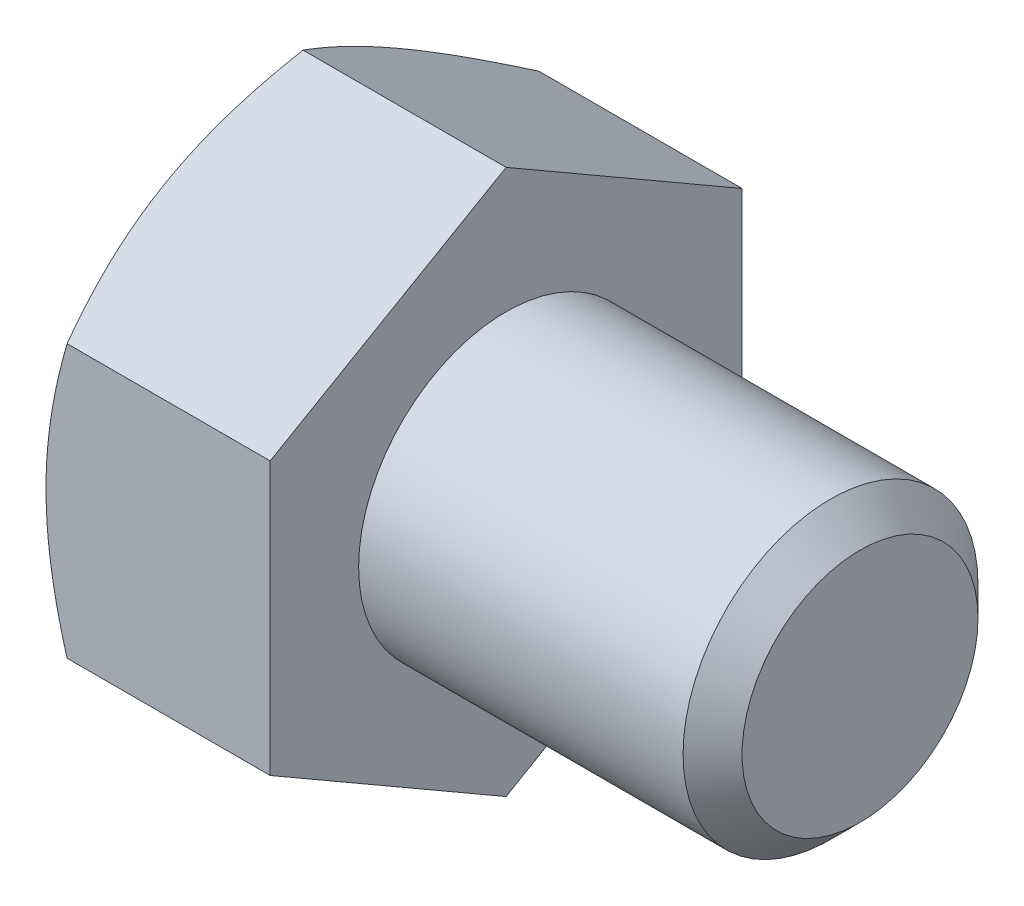
from build123d import *

# Parameters (mm, degrees)
SKETCH2_R       = 4.665127021
HEX_DIE_DEPTH   = 3.8
CHANFREIN1_SIZE = 0.5


with BuildPart() as part:
    # BodySke → Base-Revolve (revolve)
    with BuildSketch(Plane.XY, mode=Mode.PRIVATE) as base_revolve_sk:
        Polygon((3.8, 2.5), (3.8, 4.618937644), (0.357343816, 4.618937644), (0, 4), (0, 0), (9.8, 0), (9.8, 2.5), align=None)
    revolve(base_revolve_sk.sketch.rotate(Axis((-25.4, 0, 0), (1, 0, 0)), 90), axis=Axis((-25.4, 0, 0), (1, 0, 0)))

    # Sketch2 → Hex-Die (cut)
    with BuildSketch(Plane(origin=(0, 0, 0), x_dir=(0, 0, -1), z_dir=(1, 0, 0))):
        Circle(SKETCH2_R)
        Polygon((-4, 2.309401087), (0, 4.618802174), (4, 2.309401087), (4, -2.309401087), (0, -4.618802174), (-4, -2.309401087), align=None, mode=Mode.SUBTRACT)
    extrude(amount=HEX_DIE_DEPTH, mode=Mode.SUBTRACT)

    # Chanfrein1
    chanfrein1_edges = [part.edges().sort_by_distance(p)[0] for p in [
        (9.8, 0, -2.5),
    ]]
    chamfer(chanfrein1_edges, length=CHANFREIN1_SIZE)


solid = part.part
